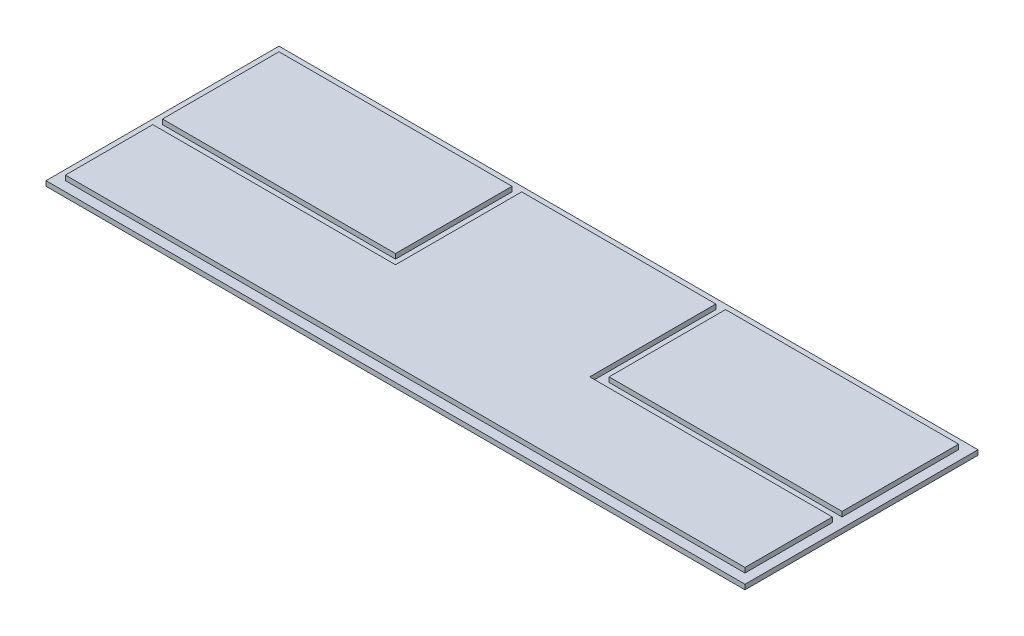
from build123d import *

# Parameters (mm, degrees)
SKETCH1_W           = 914.4
SKETCH1_H           = 304.8
BOSS_EXTRUDE1_DEPTH = 12.7
SKETCH2_W           = 914.4
SKETCH2_H           = 304.8
SKETCH2_W_2         = 304.8
SKETCH2_H_2         = 152.4
CUT_EXTRUDE1_DEPTH  = 6.35


with BuildPart() as part:
    # Sketch1 → Boss-Extrude1 (new body)
    with BuildSketch(Plane(origin=(0, 0, 0), x_dir=(1, 0, 0), z_dir=(0, 1, 0))):
        with Locations((457.2, 152.4)):
            Rectangle(SKETCH1_W, SKETCH1_H)
    extrude(amount=BOSS_EXTRUDE1_DEPTH)

    # Sketch2 → Cut-Extrude1 (cut)
    with BuildSketch(Plane(origin=(0, 12.7, 0), x_dir=(1, 0, 0), z_dir=(0, 1, 0))):
        with Locations((457.2, 152.4)):
            Rectangle(SKETCH2_W, SKETCH2_H)
        Polygon((330.2, 127), (12.7, 127), (12.7, 12.7), (901.7, 12.7), (901.7, 127), (584.2, 127), (584.2, 292.1), (330.2, 292.1), align=None, mode=Mode.SUBTRACT)
        with Locations((165.1, 215.9)):
            Rectangle(SKETCH2_W_2, SKETCH2_H_2, mode=Mode.SUBTRACT)
        with Locations((749.3, 215.9)):
            Rectangle(SKETCH2_W_2, SKETCH2_H_2, mode=Mode.SUBTRACT)
    extrude(amount=-CUT_EXTRUDE1_DEPTH, mode=Mode.SUBTRACT)


solid = part.part
